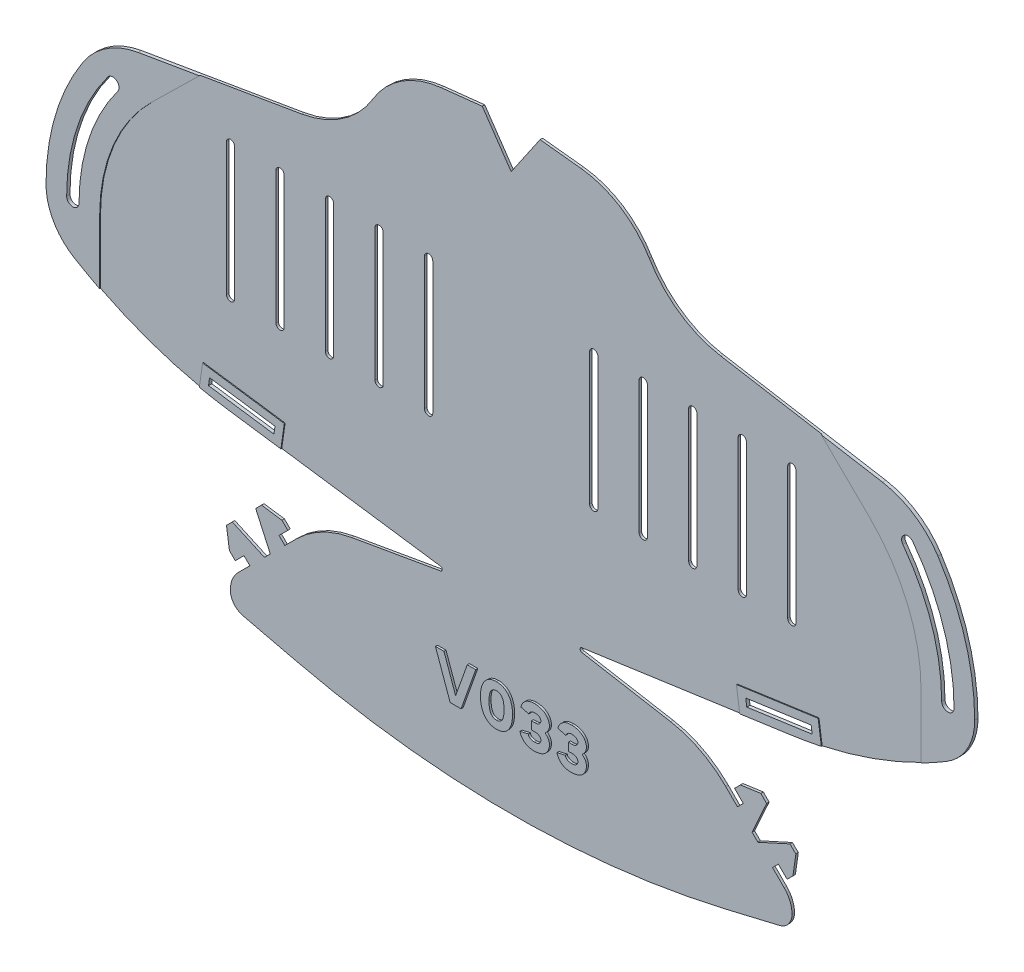
from build123d import *

# Parameters (mm, degrees)
MAIN_SHAPE_DEPTH                   = 0.6
ELASTIC_ATTACHMENT_POINTS_DEPTH    = 184.525502315
REINFORCED_ATTACHMENT_POINTS_DEPTH = 0.2
TAB_SLITS_DEPTH                    = 184.525502315
REINFORCED_TAB_SLITS_DEPTH         = 0.2
TAB_FLEX_RELIEF_DEPTH              = 184.525502315
TAB_FLEX_RELIEF_DEPTH_BACK         = 184.525502315
BREATHING_SLITS_DEPTH              = 184.525502315
VERSION_NUMBER_DEPTH               = 0.5
FILLET1_R                          = 0.5


with BuildPart() as part:
    # Sketch1 → Main Shape (new body)
    with BuildSketch(Plane.XY):
        with BuildLine():
            Line((0, -10.235233266), (-7, 0))
            Line((-7, 0), (-16.941855461, -1.076805455))
            ThreePointArc((-16.941855461, -1.076805455), (-26.448172688, -4.42923559), (-33.461443341, -11.669600897))
            ThreePointArc((-33.461443341, -11.669600897), (-40.804108255, -19.481824954), (-50.74391922, -23.5))
            Line((-50.74391922, -23.5), (-90.180351554, -30.190874742))
            ThreePointArc((-90.180351554, -30.190874742), (-97.811505455, -33.190405434), (-103.597722286, -39))
            ThreePointArc((-103.597722286, -39), (-110.227482046, -53.35351039), (-112.5, -69))
            ThreePointArc((-112.5, -69), (-110.685143325, -75.893640703), (-105.711102551, -81))
            ThreePointArc((-105.711102551, -81), (-87.655491519, -89.524485559), (-68.266232563, -94.291935705))
            Line((-68.266232563, -94.291935705), (-14, -102))
            Line((-14, -102), (-38.626554922, -106.304973016))
            ThreePointArc((-38.626554922, -106.304973016), (-45.849449199, -108.748014338), (-52, -113.254607005))
            Line((-52, -113.254607005), (-54.828307349, -116.0831539))
            Line((-54.828307349, -116.0831539), (-56.242580797, -114.669000226))
            Line((-56.242580797, -114.669000226), (-54.121350285, -112.547590054))
            Line((-54.121350285, -112.547590054), (-55.535623732, -111.13343638))
            Line((-55.535623732, -111.13343638), (-60.48540114, -110.426539202))
            Line((-60.48540114, -110.426539202), (-68.970323187, -118.912179887))
            Line((-68.970323187, -118.912179887), (-68.263006804, -123.861897408))
            Line((-68.263006804, -123.861897408), (-66.848733357, -125.276051082))
            Line((-66.848733357, -125.276051082), (-64.727502845, -123.154640911))
            Line((-64.727502845, -123.154640911), (-63.313229397, -124.568794586))
            Line((-63.313229397, -124.568794586), (-66.141536747, -127.397341481))
            ThreePointArc((-66.141536747, -127.397341481), (-67.550417669, -129.506025763), (-68.045148042, -131.993340924))
            ThreePointArc((-68.045148042, -131.993340924), (-67.183295285, -134.473669911), (-64.9691321, -135.885159709))
            Line((-64.9691321, -135.885159709), (-52.436095294, -138.860716087))
            ThreePointArc((-52.436095294, -138.860716087), (-26.397134772, -143.459954927), (0, -145))
            ThreePointArc((0, -145), (26.397134772, -143.459954927), (52.436095294, -138.860716087))
            Line((52.436095294, -138.860716087), (64.9691321, -135.885159709))
            ThreePointArc((64.9691321, -135.885159709), (67.183295285, -134.473669911), (68.045148042, -131.993340924))
            ThreePointArc((68.045148042, -131.993340924), (67.550417669, -129.506025763), (66.141536747, -127.397341481))
            Line((66.141536747, -127.397341481), (63.313229397, -124.568794586))
            Line((63.313229397, -124.568794586), (64.727502845, -123.154640911))
            Line((64.727502845, -123.154640911), (66.848733357, -125.276051082))
            Line((66.848733357, -125.276051082), (68.263006804, -123.861897408))
            Line((68.263006804, -123.861897408), (68.970323187, -118.912179887))
            Line((68.970323187, -118.912179887), (60.48540114, -110.426539202))
            Line((60.48540114, -110.426539202), (55.535623732, -111.13343638))
            Line((55.535623732, -111.13343638), (54.121350285, -112.547590054))
            Line((54.121350285, -112.547590054), (56.242580797, -114.669000226))
            Line((56.242580797, -114.669000226), (54.828307349, -116.0831539))
            Line((54.828307349, -116.0831539), (52, -113.254607005))
            ThreePointArc((52, -113.254607005), (45.849449199, -108.748014338), (38.626554922, -106.304973016))
            Line((38.626554922, -106.304973016), (14, -102))
            Line((14, -102), (68.266232563, -94.291935705))
            ThreePointArc((68.266232563, -94.291935705), (87.655491519, -89.524485559), (105.711102551, -81))
            ThreePointArc((105.711102551, -81), (110.685143325, -75.893640703), (112.5, -69))
            ThreePointArc((112.5, -69), (110.227482046, -53.35351039), (103.597722286, -39))
            ThreePointArc((103.597722286, -39), (97.811505455, -33.190405434), (90.180351554, -30.190874742))
            Line((90.180351554, -30.190874742), (50.74391922, -23.5))
            ThreePointArc((50.74391922, -23.5), (40.804108255, -19.481824954), (33.461443341, -11.669600897))
            ThreePointArc((33.461443341, -11.669600897), (26.448172688, -4.42923559), (16.941855461, -1.076805455))
            Line((16.941855461, -1.076805455), (7, 0))
            Line((7, 0), (0, -10.235233266))
        make_face()
    extrude(amount=MAIN_SHAPE_DEPTH)

    # Sketch2 → Elastic Attachment Points (cut, through all)
    with BuildSketch(Plane.XY.offset(0.6)):
        with BuildLine():
            ThreePointArc((-97.5, -39), (-104.934164903, -53.188611699), (-107.5, -69))
            ThreePointArc((-107.5, -69), (-106, -70.5), (-104.5, -69))
            ThreePointArc((-104.5, -69), (-102.088115008, -54.137294997), (-95.1, -40.8))
            ThreePointArc((-95.1, -40.8), (-95.4, -38.7), (-97.5, -39))
        make_face()
        with BuildLine():
            ThreePointArc((97.5, -39), (104.934164903, -53.188611699), (107.5, -69))
            ThreePointArc((107.5, -69), (106, -70.5), (104.5, -69))
            ThreePointArc((104.5, -69), (102.088115008, -54.137294997), (95.1, -40.8))
            ThreePointArc((95.1, -40.8), (95.4, -38.7), (97.5, -39))
        make_face()
    extrude(amount=-ELASTIC_ATTACHMENT_POINTS_DEPTH, mode=Mode.SUBTRACT)

    # Sketch7 → Reinforced Attachment Points (add)
    # profile 1 of 2: a face of its own
    with BuildSketch(Plane.XY.offset(0.6)):
        with BuildLine():
            Line((-99.5, -69), (-99.5, -84.438405623))
            ThreePointArc((-99.5, -84.438405623), (-102.636073846, -82.774338486), (-105.711102551, -81))
            ThreePointArc((-105.711102551, -81), (-110.685143325, -75.893640703), (-112.5, -69))
            ThreePointArc((-112.5, -69), (-110.227482046, -53.35351039), (-103.597722286, -39))
            ThreePointArc((-103.597722286, -39), (-97.811505455, -33.190405434), (-90.180351554, -30.190874742))
            Line((-90.180351554, -30.190874742), (-75.331937335, -27.671659038))
            Line((-75.331937335, -27.671659038), (-86.893876913, -39))
            ThreePointArc((-86.893876913, -39), (-96.22042633, -52.729517991), (-99.5, -69))
        make_face()
        with BuildLine():
            ThreePointArc((-107.5, -69), (-106, -70.5), (-104.5, -69))
            ThreePointArc((-104.5, -69), (-102.088115008, -54.137294997), (-95.1, -40.8))
            ThreePointArc((-95.1, -40.8), (-95.4, -38.7), (-97.5, -39))
            ThreePointArc((-97.5, -39), (-104.934164903, -53.188611699), (-107.5, -69))
        make_face(mode=Mode.SUBTRACT)
    # profile 2 of 2: a face of its own
    with BuildSketch(Plane.XY.offset(0.6)):
        with BuildLine():
            Line((75.331937335, -27.671659038), (90.180351554, -30.190874742))
            ThreePointArc((90.180351554, -30.190874742), (97.811505455, -33.190405434), (103.597722286, -39))
            ThreePointArc((103.597722286, -39), (110.227482046, -53.35351039), (112.5, -69))
            ThreePointArc((112.5, -69), (110.685143325, -75.893640703), (105.711102551, -81))
            ThreePointArc((105.711102551, -81), (102.636073846, -82.774338486), (99.5, -84.438405623))
            Line((99.5, -84.438405623), (99.5, -69))
            ThreePointArc((99.5, -69), (96.22042633, -52.729517991), (86.893876913, -39))
            Line((86.893876913, -39), (75.331937335, -27.671659038))
        make_face()
        with BuildLine():
            ThreePointArc((104.5, -69), (106, -70.5), (107.5, -69))
            ThreePointArc((107.5, -69), (104.934164903, -53.188611699), (97.5, -39))
            ThreePointArc((97.5, -39), (95.4, -38.7), (95.1, -40.8))
            ThreePointArc((95.1, -40.8), (102.088115008, -54.137294997), (104.5, -69))
        make_face(mode=Mode.SUBTRACT)
    extrude(amount=REINFORCED_ATTACHMENT_POINTS_DEPTH)

    # Sketch6 → Tab Slits (cut, through all)
    with BuildSketch(Plane.XY.offset(0.6)):
        Polygon((-73.122472744, -91.582072346), (-57.281477317, -93.832153206), (-57.02834322, -92.050041221), (-72.869338647, -89.79996036), align=None)
        Polygon((73.122472744, -91.582072346), (72.869338647, -89.79996036), (57.02834322, -92.050041221), (57.281477317, -93.832153206), align=None)
    extrude(amount=-TAB_SLITS_DEPTH, mode=Mode.SUBTRACT)

    # Sketch9 → Reinforced Tab Slits (add)
    # profile 1 of 2: a face of its own
    with BuildSketch(Plane.XY.offset(0.6)):
        with BuildLine():
            Line((-55.582612996, -96.093537742), (-54.766958684, -90.3511769))
            Line((-54.766958684, -90.3511769), (-74.568202968, -87.538575825))
            Line((-74.568202968, -87.538575825), (-75.347469499, -93.024759795))
            ThreePointArc((-75.347469499, -93.024759795), (-71.81824936, -93.72204393), (-68.266232563, -94.291935705))
            Line((-68.266232563, -94.291935705), (-55.582612996, -96.093537742))
        make_face()
        Polygon((-57.281477317, -93.832153206), (-57.02834322, -92.050041221), (-72.869338647, -89.79996036), (-73.122472744, -91.582072346), align=None, mode=Mode.SUBTRACT)
    # profile 2 of 2: a face of its own
    with BuildSketch(Plane.XY.offset(0.6)):
        with BuildLine():
            Line((68.266232563, -94.291935705), (55.582612996, -96.093537742))
            Line((55.582612996, -96.093537742), (54.766958684, -90.3511769))
            Line((54.766958684, -90.3511769), (74.568202968, -87.538575825))
            Line((74.568202968, -87.538575825), (75.347469499, -93.024759795))
            ThreePointArc((75.347469499, -93.024759795), (71.81824936, -93.72204393), (68.266232563, -94.291935705))
        make_face()
        Polygon((57.02834322, -92.050041221), (72.869338647, -89.79996036), (73.122472744, -91.582072346), (57.281477317, -93.832153206), align=None, mode=Mode.SUBTRACT)
    extrude(amount=REINFORCED_TAB_SLITS_DEPTH)

    # Sketch11 → Tab Flex Relief (cut, two sides: drawn at the far end of the back side and taken through both)
    with BuildSketch(Plane.XY.offset(0.6).offset(-TAB_FLEX_RELIEF_DEPTH_BACK)):
        Polygon((-67.556169513, -117.49790644), (-59.777845211, -121.033110967), (-58.363691536, -119.618837519), (-61.899554814, -111.840812649), align=None)
        Polygon((61.899554814, -111.840812649), (67.556169513, -117.49790644), (59.777845211, -121.033110967), (58.363691536, -119.618837519), align=None)
    extrude(amount=TAB_FLEX_RELIEF_DEPTH + TAB_FLEX_RELIEF_DEPTH_BACK, mode=Mode.SUBTRACT)

    # Sketch3 → Breathing Slits (cut, through all)
    with BuildSketch(Plane.XY.offset(0.6)):
        with BuildLine():
            Line((-19, -38.45), (-19, -70.45))
            ThreePointArc((-19, -70.45), (-20, -71.45), (-21, -70.45))
            Line((-21, -70.45), (-21, -38.45))
            ThreePointArc((-21, -38.45), (-20, -37.45), (-19, -38.45))
        make_face()
        with BuildLine():
            Line((-31, -38.45), (-31, -70.45))
            ThreePointArc((-31, -70.45), (-32, -71.45), (-33, -70.45))
            Line((-33, -70.45), (-33, -38.45))
            ThreePointArc((-33, -38.45), (-32, -37.45), (-31, -38.45))
        make_face()
        with BuildLine():
            Line((-43, -38.45), (-43, -70.45))
            ThreePointArc((-43, -70.45), (-44, -71.45), (-45, -70.45))
            Line((-45, -70.45), (-45, -38.45))
            ThreePointArc((-45, -38.45), (-44, -37.45), (-43, -38.45))
        make_face()
        with BuildLine():
            Line((-55, -38.45), (-55, -70.45))
            ThreePointArc((-55, -70.45), (-56, -71.45), (-57, -70.45))
            Line((-57, -70.45), (-57, -38.45))
            ThreePointArc((-57, -38.45), (-56, -37.45), (-55, -38.45))
        make_face()
        with BuildLine():
            Line((-67, -38.45), (-67, -70.45))
            ThreePointArc((-67, -70.45), (-68, -71.45), (-69, -70.45))
            Line((-69, -70.45), (-69, -38.45))
            ThreePointArc((-69, -38.45), (-68, -37.45), (-67, -38.45))
        make_face()
        with BuildLine():
            Line((19, -38.45), (19, -70.45))
            ThreePointArc((19, -70.45), (20, -71.45), (21, -70.45))
            Line((21, -70.45), (21, -38.45))
            ThreePointArc((21, -38.45), (20, -37.45), (19, -38.45))
        make_face()
        with BuildLine():
            Line((31, -38.45), (31, -70.45))
            ThreePointArc((31, -70.45), (32, -71.45), (33, -70.45))
            Line((33, -70.45), (33, -38.45))
            ThreePointArc((33, -38.45), (32, -37.45), (31, -38.45))
        make_face()
        with BuildLine():
            Line((43, -38.45), (43, -70.45))
            ThreePointArc((43, -70.45), (44, -71.45), (45, -70.45))
            Line((45, -70.45), (45, -38.45))
            ThreePointArc((45, -38.45), (44, -37.45), (43, -38.45))
        make_face()
        with BuildLine():
            Line((55, -38.45), (55, -70.45))
            ThreePointArc((55, -70.45), (56, -71.45), (57, -70.45))
            Line((57, -70.45), (57, -38.45))
            ThreePointArc((57, -38.45), (56, -37.45), (55, -38.45))
        make_face()
        with BuildLine():
            Line((67, -38.45), (67, -70.45))
            ThreePointArc((67, -70.45), (68, -71.45), (69, -70.45))
            Line((69, -70.45), (69, -38.45))
            ThreePointArc((69, -38.45), (68, -37.45), (67, -38.45))
        make_face()
    extrude(amount=-BREATHING_SLITS_DEPTH, mode=Mode.SUBTRACT)

    # Sketch8 → Version Number (add)
    # profile 1 of 4: a face of its own
    with BuildSketch(Plane.XY.offset(0.6)):
        Polygon((-14.279551662, -128.5), (-11.644631028, -128.5), (-8.073202456, -118.5), (-10.13669452, -118.5), (-12.962091345, -126.420634921), (-15.78748817, -118.5), (-17.850980234, -118.5), align=None)
    # profile 2 of 4: a face of its own
    with BuildSketch(Plane.XY.offset(0.6)):
        with BuildLine():
            add(Edge.make_bspline(
                [(-3.051027777, -118.5), (-3.19539374, -118.505695671), (-3.478148888, -118.51685121), (-3.891283889, -118.5745591), (-4.279126593, -118.680335178), (-4.646328168, -118.819656178), (-4.98860374, -119.003303471), (-5.312396914, -119.221085059), (-5.605407529, -119.487440084), (-5.880862582, -119.785519386), (-6.126725763, -120.12453761), (-6.340161473, -120.500892889), (-6.522124249, -120.912503383), (-6.671045413, -121.360169436), (-6.786594461, -121.844506854), (-6.8743484, -122.364485904), (-6.925902839, -122.921030718), (-6.936559569, -123.303893775), (-6.942038151, -123.500722112)],
                knots=[0, 0, 0, 0, 0.970159994, 1.900155169, 2.79438565, 3.665191596, 4.532301255, 5.397946305, 6.279238358, 7.185391655, 8.120220805, 9.085107467, 10.08639026, 11.138349125, 12.249459105, 13.427760297, 14.677622047, 16, 16, 16, 16], degree=3))
            add(Edge.make_bspline(
                [(-6.942038151, -123.500722112), (-6.93661476, -123.69832053), (-6.926106134, -124.081196856), (-6.874139064, -124.637697099), (-6.786693174, -125.156966907), (-6.670583318, -125.641884177), (-6.522640654, -126.090648826), (-6.340094029, -126.502814664), (-6.126783725, -126.879260377), (-5.880702545, -127.218032326), (-5.606310807, -127.51659595), (-5.310843261, -127.779877259), (-4.989492019, -128.000979952), (-4.646134714, -128.183632701), (-4.279581659, -128.324409639), (-3.89062858, -128.425104033), (-3.47885026, -128.488808035), (-3.196068886, -128.496221224), (-3.051924811, -128.5)],
                knots=[0, 0, 0, 0, 1.327400251, 2.57203543, 3.750234214, 4.861247624, 5.917991082, 6.919186852, 7.883989653, 8.818737555, 9.724812096, 10.602616666, 11.47109776, 12.338132057, 13.208862319, 14.101698703, 15.032365954, 16, 16, 16, 16], degree=3))
            add(Edge.make_bspline(
                [(-3.051924811, -128.5), (-2.907785142, -128.496210687), (-2.625012412, -128.488776824), (-2.213171998, -128.425221319), (-1.823749667, -128.323813307), (-1.456388189, -128.184839888), (-1.11399871, -128.000200623), (-0.792952303, -127.779984633), (-0.497553635, -127.516566079), (-0.223143835, -127.218040576), (0.022936792, -126.879258594), (0.236229534, -126.502813072), (0.418851411, -126.090657611), (0.566489149, -125.641847927), (0.683801999, -125.157235462), (0.766244145, -124.637275213), (0.82390037, -124.081441513), (0.831810739, -123.698369528), (0.835892123, -123.500722112)],
                knots=[0, 0, 0, 0, 0.96765053, 1.898333634, 2.791185227, 3.666728435, 4.529238626, 5.397734515, 6.275554038, 7.181644014, 8.116407839, 9.081227075, 10.082439899, 11.139201358, 12.250233695, 13.427610983, 14.672766316, 16, 16, 16, 16], degree=3))
            add(Edge.make_bspline(
                [(0.835892123, -123.500722112), (0.831751293, -123.303845261), (0.823694588, -122.920787111), (0.766450609, -122.364907693), (0.683702415, -121.844238468), (0.566952779, -121.360205444), (0.418334814, -120.912494629), (0.236296996, -120.500894477), (0.022878819, -120.124539393), (-0.222983775, -119.785511139), (-0.498457012, -119.487469991), (-0.79139822, -119.220977415), (-1.114883082, -119.004075275), (-1.45619473, -118.818455332), (-1.824205294, -118.680915067), (-2.212521926, -118.574534625), (-2.625371004, -118.516562336), (-2.907855835, -118.506550382), (-3.051924811, -118.501444225)],
                knots=[0, 0, 0, 0, 1.322391154, 2.572941942, 3.750582404, 4.861863084, 5.913983562, 6.915420183, 7.880455081, 8.815427849, 9.721720359, 10.603147806, 11.468925845, 12.331628829, 13.207367743, 14.101735605, 15.031873656, 16, 16, 16, 16], degree=3))
            Line((-3.051924811, -118.501444225), (-3.051027777, -118.5))
        make_face()
        with BuildLine():
            add(Edge.make_bspline(
                [(-3.051027777, -126.579365079), (-3.120347324, -126.580142247), (-3.25635765, -126.581667111), (-3.453810887, -126.549518886), (-3.640261982, -126.50001124), (-3.814439277, -126.424863461), (-3.978234638, -126.32888552), (-4.128850181, -126.207295998), (-4.267209205, -126.063513987), (-4.394524263, -125.896932623), (-4.508395565, -125.703005633), (-4.606926554, -125.478827118), (-4.687663969, -125.222713054), (-4.756840727, -124.937433189), (-4.808092092, -124.621763618), (-4.846595657, -124.276117752), (-4.872462321, -123.899148475), (-4.875821596, -123.63702081), (-4.87756832, -123.500722112)],
                knots=[0, 0, 0, 0, 0.820209436, 1.609314487, 2.362064528, 3.101854642, 3.850272983, 4.605479342, 5.3882482, 6.210255141, 7.084711649, 8.047345167, 9.106040688, 10.263495908, 11.523832392, 12.893430008, 14.384674726, 16, 16, 16, 16], degree=3))
            add(Edge.make_bspline(
                [(-4.87756832, -123.500722112), (-4.875814709, -123.364424703), (-4.87244219, -123.102299516), (-4.846666545, -122.725313211), (-4.807773571, -122.378974061), (-4.757477287, -122.063111109), (-4.687259864, -121.778059679), (-4.606956833, -121.522619394), (-4.508426672, -121.298401339), (-4.394392013, -121.104640769), (-4.268001709, -120.937923887), (-4.128039223, -120.796456824), (-3.978318472, -120.674830172), (-3.814478587, -120.578630118), (-3.639832567, -120.50465551), (-3.45446502, -120.450210023), (-3.256321312, -120.423926373), (-3.120878039, -120.422146526), (-3.051924811, -120.421240419)],
                knots=[0, 0, 0, 0, 1.616177311, 3.108208617, 4.478528655, 5.748482895, 6.897727805, 7.956981757, 8.920123036, 9.795040793, 10.617481319, 11.394165711, 12.149770419, 12.898583529, 13.63876386, 14.394368568, 15.182584207, 16, 16, 16, 16], degree=3))
            add(Edge.make_bspline(
                [(-3.051924811, -120.421240419), (-2.982973175, -120.422149219), (-2.847533031, -120.423934355), (-2.64936681, -120.450179948), (-2.464080223, -120.504762296), (-2.289746876, -120.577982734), (-2.127521541, -120.675595023), (-1.978051783, -120.796360516), (-1.838151536, -120.937948802), (-1.711787224, -121.104645093), (-1.597562487, -121.298351736), (-1.499777206, -121.523063414), (-1.415817348, -121.777554553), (-1.346628249, -122.063195246), (-1.29599857, -122.378948588), (-1.257206456, -122.725320897), (-1.231400792, -123.102297333), (-1.228032641, -123.364423957), (-1.226281301, -123.500722112)],
                knots=[0, 0, 0, 0, 0.817669415, 1.606129616, 2.361968767, 3.102378757, 3.843623451, 4.599462602, 5.376387978, 6.199083685, 7.074272906, 8.037713021, 9.100132017, 10.249733507, 11.520081779, 12.89082699, 14.383321233, 16, 16, 16, 16], degree=3))
            add(Edge.make_bspline(
                [(-1.226281301, -123.500722112), (-1.228025755, -123.637021556), (-1.231380663, -123.899150658), (-1.257277338, -124.276110066), (-1.295680288, -124.621789015), (-1.347263507, -124.937349474), (-1.415405372, -125.223220708), (-1.499806884, -125.478383327), (-1.597593739, -125.703055181), (-1.711654918, -125.896928348), (-1.838944061, -126.063488884), (-1.977240151, -126.207393621), (-2.12760424, -126.328120602), (-2.289785467, -126.425517476), (-2.463650718, -126.499891817), (-2.650020055, -126.549600883), (-2.847209684, -126.581404352), (-2.98290822, -126.580608552), (-3.051924811, -126.580203806)],
                knots=[0, 0, 0, 0, 1.616177474, 3.108208932, 4.478529109, 5.739530511, 6.897596372, 7.959685938, 8.922827315, 9.797745161, 10.620185771, 11.403367596, 12.15897238, 12.899987232, 13.640167639, 14.39331481, 15.182836171, 16, 16, 16, 16], degree=3))
            Line((-3.051924811, -126.580203806), (-3.051027777, -126.579365079))
        make_face(mode=Mode.SUBTRACT)
    # profile 3 of 4: a face of its own
    with BuildSketch(Plane.XY.offset(0.6)):
        with BuildLine():
            Line((6.271577031, -124.404761905), (6.366815126, -124.404761905))
            add(Edge.make_bspline(
                [(6.366815126, -124.404761905), (6.467083021, -124.411299477), (6.657718223, -124.423729091), (6.924384519, -124.486416557), (7.157178608, -124.578961335), (7.348865985, -124.709274647), (7.502511287, -124.861365804), (7.616838726, -125.032278467), (7.68649997, -125.222537651), (7.695375407, -125.355662585), (7.699852438, -125.422814713)],
                knots=[0, 0, 0, 0, 1.293250512, 2.458803691, 3.516087315, 4.504014474, 5.424976382, 6.287022232, 7.135923681, 8, 8, 8, 8], degree=3))
            add(Edge.make_bspline(
                [(7.699852438, -125.422814713), (7.696562888, -125.504440638), (7.690201902, -125.662280257), (7.62105453, -125.887718235), (7.502699673, -126.087113891), (7.367783836, -126.23073656), (7.23861918, -126.331172702), (7.123730184, -126.395688771), (6.994879285, -126.450185226), (6.851851279, -126.49595932), (6.69512982, -126.532200484), (6.524170883, -126.560253509), (6.33834716, -126.575366879), (6.209508164, -126.5785552), (6.142888539, -126.580203806)],
                knots=[0, 0, 0, 0, 1.334208421, 2.579951764, 3.816761299, 5.103436918, 5.78324123, 6.491044783, 7.25516555, 8.072210043, 8.94833879, 9.888551629, 10.908219533, 12, 12, 12, 12], degree=3))
            add(Edge.make_bspline(
                [(6.142888539, -126.580203806), (6.068494948, -126.579024673), (5.918010355, -126.576639503), (5.691363809, -126.537785365), (5.463088851, -126.472292557), (5.235991452, -126.384048723), (5.021834851, -126.26078738), (4.844512322, -126.088542309), (4.703342567, -125.87591894), (4.648773412, -125.712337396), (4.620370744, -125.62719493)],
                knots=[0, 0, 0, 0, 0.920255672, 1.861508472, 2.836752399, 3.857684402, 4.873720033, 5.872631744, 6.892727297, 8, 8, 8, 8], degree=3))
            Line((4.620370744, -125.62719493), (2.636656396, -126.071428571))
            add(Edge.make_bspline(
                [(2.636656396, -126.071428571), (2.65949168, -126.160336196), (2.704447825, -126.335369884), (2.797456704, -126.586847228), (2.908894142, -126.824009097), (3.034050485, -127.050933458), (3.182201572, -127.26169635), (3.346370111, -127.459934114), (3.525601641, -127.647890635), (3.725933933, -127.819546753), (3.943380911, -127.976110236), (4.180527485, -128.112422888), (4.435092983, -128.230322428), (4.710630373, -128.322934743), (5.002747988, -128.399729339), (5.314016557, -128.45295857), (5.642847536, -128.491934936), (5.868729028, -128.497268097), (5.984436461, -128.5)],
                knots=[0, 0, 0, 0, 0.97897001, 1.927311989, 2.855460552, 3.773345826, 4.68872018, 5.599601379, 6.518067916, 7.456260856, 8.41049365, 9.372940738, 10.370680865, 11.39871829, 12.470472684, 13.590411754, 14.765692276, 16, 16, 16, 16], degree=3))
            add(Edge.make_bspline(
                [(5.984436461, -128.5), (6.140706347, -128.494245394), (6.443232397, -128.483104934), (6.881041186, -128.435865678), (7.286689568, -128.358387224), (7.66046436, -128.252017359), (8.005338054, -128.123277608), (8.316323474, -127.961059217), (8.598414909, -127.774497038), (8.846068931, -127.55815064), (9.060463644, -127.319870658), (9.252221218, -127.071551477), (9.410010509, -126.805353082), (9.542541163, -126.527874631), (9.641168787, -126.234513517), (9.712632491, -125.928607165), (9.754304892, -125.607680152), (9.759422526, -125.38925418), (9.762025861, -125.278141077)],
                knots=[0, 0, 0, 0, 1.338573179, 2.591371041, 3.766159492, 4.869841347, 5.915366975, 6.911991706, 7.866279139, 8.804635322, 9.718527085, 10.607232931, 11.486170613, 12.362759498, 13.235296616, 14.130311397, 15.048891017, 16, 16, 16, 16], degree=3))
            add(Edge.make_bspline(
                [(9.762025861, -125.278141077), (9.756677435, -125.181448476), (9.746150675, -124.991138356), (9.69083509, -124.713321084), (9.598475202, -124.451246621), (9.469283463, -124.20784025), (9.318083758, -123.977552327), (9.142952342, -123.764837772), (8.948555296, -123.566155092), (8.80413063, -123.449574998), (8.73093915, -123.39049458)],
                knots=[0, 0, 0, 0, 1.042147361, 2.051151675, 3.039496243, 4.024119517, 5.012016893, 6.002285516, 6.987598979, 8, 8, 8, 8], degree=3))
            add(Edge.make_bspline(
                [(8.73093915, -123.39049458), (8.804120184, -123.325162044), (8.948480941, -123.19628365), (9.142753063, -122.981710509), (9.316923769, -122.755542958), (9.470279521, -122.515248899), (9.597481046, -122.261642739), (9.690305135, -121.993228321), (9.746213398, -121.711764564), (9.756698785, -121.519933272), (9.762025861, -121.42247384)],
                knots=[0, 0, 0, 0, 1.026734164, 2.025389794, 3.025877614, 4.013273499, 5.006315215, 5.989929209, 6.978788314, 8, 8, 8, 8], degree=3))
            add(Edge.make_bspline(
                [(9.762025861, -121.42247384), (9.757943996, -121.322020203), (9.749925017, -121.124675201), (9.70298232, -120.835115028), (9.627804305, -120.558271626), (9.520362248, -120.294880847), (9.386946652, -120.042407113), (9.222134738, -119.803370965), (9.03110556, -119.574583887), (8.810274701, -119.361344215), (8.563575543, -119.166999953), (8.291767327, -118.995833154), (7.997228637, -118.84746887), (7.676452584, -118.730513446), (7.334536967, -118.632405283), (6.968657131, -118.562780212), (6.579581976, -118.515976725), (6.312193885, -118.506371293), (6.175038236, -118.501444225)],
                knots=[0, 0, 0, 0, 0.933249724, 1.833404674, 2.71837752, 3.592513965, 4.4704886, 5.365912677, 6.284554944, 7.234984132, 8.212272519, 9.196674926, 10.214289296, 11.269589965, 12.363543901, 13.515449053, 14.72555956, 16, 16, 16, 16], degree=3))
            add(Edge.make_bspline(
                [(6.175038236, -118.501444225), (6.061645884, -118.504384419), (5.840465125, -118.510119502), (5.517680855, -118.546209564), (5.21185155, -118.597359567), (4.923032824, -118.671164203), (4.651989267, -118.76520159), (4.398267184, -118.877770477), (4.16173765, -119.009217236), (3.94413438, -119.161041577), (3.743873805, -119.328960798), (3.562476817, -119.510905494), (3.397729823, -119.704452098), (3.253195647, -119.91288512), (3.123566172, -120.132286581), (3.017031143, -120.36651166), (2.922112184, -120.610059019), (2.878707966, -120.780460499), (2.856730222, -120.866743363)],
                knots=[0, 0, 0, 0, 1.229240767, 2.397731417, 3.51786287, 4.588673614, 5.625367482, 6.624717489, 7.594406979, 8.554388623, 9.496885304, 10.424058211, 11.336820069, 12.248524965, 13.170856983, 14.095351914, 15.035580601, 16, 16, 16, 16], degree=3))
            Line((2.856730222, -120.866743363), (4.763640523, -121.373015873))
            add(Edge.make_bspline(
                [(4.763640523, -121.373015873), (4.774938173, -121.326631527), (4.799454349, -121.22597637), (4.889955476, -121.081457089), (5.01180415, -120.927147787), (5.173016925, -120.771324055), (5.370394698, -120.625559671), (5.608484676, -120.514206488), (5.881569063, -120.446844288), (6.0743985, -120.430020784), (6.175038236, -120.421240419)],
                knots=[0, 0, 0, 0, 0.626586808, 1.359708585, 2.222843852, 3.223153095, 4.308434095, 5.447412619, 6.667777482, 8, 8, 8, 8], degree=3))
            add(Edge.make_bspline(
                [(6.175038236, -120.421240419), (6.247071222, -120.423218633), (6.385306711, -120.42701494), (6.582710033, -120.449676308), (6.76300166, -120.474391788), (6.924051066, -120.515621967), (7.069666073, -120.558109891), (7.194275259, -120.618078056), (7.305036594, -120.680273756), (7.419940282, -120.780934624), (7.534268273, -120.912654377), (7.637262225, -121.077310889), (7.69725924, -121.24921056), (7.698998308, -121.365405566), (7.699852438, -121.42247384)],
                knots=[0, 0, 0, 0, 1.26888152, 2.435057415, 3.499383416, 4.470882074, 5.362320585, 6.164854387, 6.902680001, 7.591682225, 8.843898063, 9.963361673, 10.999720905, 12, 12, 12, 12], degree=3))
            add(Edge.make_bspline(
                [(7.699852438, -121.42247384), (7.694781684, -121.49199044), (7.684703485, -121.630155711), (7.609424673, -121.827940252), (7.48789936, -122.008163808), (7.324572613, -122.171288708), (7.117236705, -122.307565764), (6.86969973, -122.408872593), (6.582819396, -122.47003825), (6.378964553, -122.480300003), (6.271487327, -122.485710249)],
                knots=[0, 0, 0, 0, 0.842573162, 1.674626639, 2.532888499, 3.465967991, 4.458251597, 5.524776888, 6.695002246, 8, 8, 8, 8], degree=3))
            Line((6.271487327, -122.485710249), (5.414434173, -122.484126984))
            Line((5.414434173, -122.484126984), (5.414434173, -124.404761905))
            Line((5.414434173, -124.404761905), (6.271577031, -124.404761905))
        make_face()
    # profile 4 of 4: a face of its own
    with BuildSketch(Plane.XY.offset(0.6)):
        with BuildLine():
            Line((15.236749687, -124.404761905), (15.331987782, -124.404761905))
            add(Edge.make_bspline(
                [(15.331987782, -124.404761905), (15.432255678, -124.411299477), (15.622890879, -124.423729091), (15.889557176, -124.486416557), (16.122351264, -124.578961335), (16.314038642, -124.709274647), (16.467683943, -124.861365804), (16.582011382, -125.032278467), (16.651672626, -125.222537651), (16.660548063, -125.355662585), (16.665025095, -125.422814713)],
                knots=[0, 0, 0, 0, 1.293250512, 2.458803691, 3.516087315, 4.504014474, 5.424976382, 6.287022232, 7.135923681, 8, 8, 8, 8], degree=3))
            add(Edge.make_bspline(
                [(16.665025095, -125.422814713), (16.661735544, -125.504440638), (16.655374558, -125.662280257), (16.586227187, -125.887718235), (16.467872329, -126.087113891), (16.332956492, -126.23073656), (16.203791837, -126.331172702), (16.088902841, -126.395688771), (15.960051942, -126.450185226), (15.817023936, -126.49595932), (15.660302476, -126.532200484), (15.489343539, -126.560253509), (15.303519817, -126.575366879), (15.174680821, -126.5785552), (15.108061196, -126.580203806)],
                knots=[0, 0, 0, 0, 1.334208421, 2.579951764, 3.816761299, 5.103436918, 5.78324123, 6.491044783, 7.25516555, 8.072210043, 8.94833879, 9.888551629, 10.908219533, 12, 12, 12, 12], degree=3))
            add(Edge.make_bspline(
                [(15.108061196, -126.580203806), (15.033667605, -126.579024673), (14.883183012, -126.576639503), (14.656536466, -126.537785365), (14.428261508, -126.472292557), (14.201164108, -126.384048723), (13.987007508, -126.26078738), (13.809684979, -126.088542309), (13.668515223, -125.87591894), (13.613946069, -125.712337396), (13.585543401, -125.62719493)],
                knots=[0, 0, 0, 0, 0.920255672, 1.861508472, 2.836752399, 3.857684402, 4.873720033, 5.872631744, 6.892727297, 8, 8, 8, 8], degree=3))
            Line((13.585543401, -125.62719493), (11.601829052, -126.071428571))
            add(Edge.make_bspline(
                [(11.601829052, -126.071428571), (11.624664337, -126.160336196), (11.669620481, -126.335369884), (11.762629361, -126.586847228), (11.874066798, -126.824009097), (11.999223142, -127.050933458), (12.147374228, -127.26169635), (12.311542768, -127.459934114), (12.490774297, -127.647890635), (12.69110659, -127.819546753), (12.908553568, -127.976110236), (13.145700141, -128.112422888), (13.40026564, -128.230322428), (13.675803029, -128.322934743), (13.967920645, -128.399729339), (14.279189214, -128.45295857), (14.608020193, -128.491934936), (14.833901685, -128.497268097), (14.949609117, -128.5)],
                knots=[0, 0, 0, 0, 0.97897001, 1.927311989, 2.855460552, 3.773345826, 4.68872018, 5.599601379, 6.518067916, 7.456260856, 8.41049365, 9.372940738, 10.370680865, 11.39871829, 12.470472684, 13.590411754, 14.765692276, 16, 16, 16, 16], degree=3))
            add(Edge.make_bspline(
                [(14.949609117, -128.5), (15.105879003, -128.494245394), (15.408405054, -128.483104934), (15.846213843, -128.435865678), (16.251862225, -128.358387224), (16.625637017, -128.252017359), (16.97051071, -128.123277608), (17.281496131, -127.961059217), (17.563587566, -127.774497038), (17.811241588, -127.55815064), (18.025636301, -127.319870658), (18.217393875, -127.071551477), (18.375183166, -126.805353082), (18.50771382, -126.527874631), (18.606341444, -126.234513517), (18.677805148, -125.928607165), (18.719477549, -125.607680152), (18.724595182, -125.38925418), (18.727198518, -125.278141077)],
                knots=[0, 0, 0, 0, 1.338573179, 2.591371041, 3.766159492, 4.869841347, 5.915366975, 6.911991706, 7.866279139, 8.804635322, 9.718527085, 10.607232931, 11.486170613, 12.362759498, 13.235296616, 14.130311397, 15.048891017, 16, 16, 16, 16], degree=3))
            add(Edge.make_bspline(
                [(18.727198518, -125.278141077), (18.721850091, -125.181448476), (18.711323332, -124.991138356), (18.656007747, -124.713321084), (18.563647859, -124.451246621), (18.43445612, -124.20784025), (18.283256415, -123.977552327), (18.108124998, -123.764837772), (17.913727952, -123.566155092), (17.769303286, -123.449574998), (17.696111806, -123.39049458)],
                knots=[0, 0, 0, 0, 1.042147361, 2.051151675, 3.039496243, 4.024119517, 5.012016893, 6.002285516, 6.987598979, 8, 8, 8, 8], degree=3))
            add(Edge.make_bspline(
                [(17.696111806, -123.39049458), (17.769292841, -123.325162044), (17.913653598, -123.19628365), (18.10792572, -122.981710509), (18.282096426, -122.755542958), (18.435452178, -122.515248899), (18.562653702, -122.261642739), (18.655477791, -121.993228321), (18.711386055, -121.711764564), (18.721871442, -121.519933272), (18.727198518, -121.42247384)],
                knots=[0, 0, 0, 0, 1.026734164, 2.025389794, 3.025877614, 4.013273499, 5.006315215, 5.989929209, 6.978788314, 8, 8, 8, 8], degree=3))
            add(Edge.make_bspline(
                [(18.727198518, -121.42247384), (18.723116653, -121.322020203), (18.715097674, -121.124675201), (18.668154976, -120.835115028), (18.592976962, -120.558271626), (18.485534904, -120.294880847), (18.352119309, -120.042407113), (18.187307394, -119.803370965), (17.996278216, -119.574583887), (17.775447358, -119.361344215), (17.5287482, -119.166999953), (17.256939983, -118.995833154), (16.962401294, -118.84746887), (16.641625241, -118.730513446), (16.299709624, -118.632405283), (15.933829787, -118.562780212), (15.544754633, -118.515976725), (15.277366541, -118.506371293), (15.140210893, -118.501444225)],
                knots=[0, 0, 0, 0, 0.933249724, 1.833404674, 2.71837752, 3.592513965, 4.4704886, 5.365912677, 6.284554944, 7.234984132, 8.212272519, 9.196674926, 10.214289296, 11.269589965, 12.363543901, 13.515449053, 14.72555956, 16, 16, 16, 16], degree=3))
            add(Edge.make_bspline(
                [(15.140210893, -118.501444225), (15.02681854, -118.504384419), (14.805637781, -118.510119502), (14.482853511, -118.546209564), (14.177024207, -118.597359567), (13.888205481, -118.671164203), (13.617161924, -118.76520159), (13.36343984, -118.877770477), (13.126910307, -119.009217236), (12.909307037, -119.161041577), (12.709046461, -119.328960798), (12.527649473, -119.510905494), (12.36290248, -119.704452098), (12.218368304, -119.91288512), (12.088738829, -120.132286581), (11.9822038, -120.36651166), (11.887284841, -120.610059019), (11.843880623, -120.780460499), (11.821902878, -120.866743363)],
                knots=[0, 0, 0, 0, 1.229240767, 2.397731417, 3.51786287, 4.588673614, 5.625367482, 6.624717489, 7.594406979, 8.554388623, 9.496885304, 10.424058211, 11.336820069, 12.248524965, 13.170856983, 14.095351914, 15.035580601, 16, 16, 16, 16], degree=3))
            Line((11.821902878, -120.866743363), (13.728813179, -121.373015873))
            add(Edge.make_bspline(
                [(13.728813179, -121.373015873), (13.74011083, -121.326631527), (13.764627005, -121.22597637), (13.855128132, -121.081457089), (13.976976807, -120.927147787), (14.138189582, -120.771324055), (14.335567355, -120.625559671), (14.573657333, -120.514206488), (14.846741719, -120.446844288), (15.039571157, -120.430020784), (15.140210893, -120.421240419)],
                knots=[0, 0, 0, 0, 0.626586808, 1.359708585, 2.222843852, 3.223153095, 4.308434095, 5.447412619, 6.667777482, 8, 8, 8, 8], degree=3))
            add(Edge.make_bspline(
                [(15.140210893, -120.421240419), (15.212243879, -120.423218633), (15.350479367, -120.42701494), (15.547882689, -120.449676308), (15.728174317, -120.474391788), (15.889223723, -120.515621967), (16.03483873, -120.558109891), (16.159447916, -120.618078056), (16.270209251, -120.680273756), (16.385112939, -120.780934624), (16.499440929, -120.912654377), (16.602434882, -121.077310889), (16.662431897, -121.24921056), (16.664170965, -121.365405566), (16.665025095, -121.42247384)],
                knots=[0, 0, 0, 0, 1.26888152, 2.435057415, 3.499383416, 4.470882074, 5.362320585, 6.164854387, 6.902680001, 7.591682225, 8.843898063, 9.963361673, 10.999720905, 12, 12, 12, 12], degree=3))
            add(Edge.make_bspline(
                [(16.665025095, -121.42247384), (16.659954341, -121.49199044), (16.649876142, -121.630155711), (16.57459733, -121.827940252), (16.453072017, -122.008163808), (16.28974527, -122.171288708), (16.082409362, -122.307565764), (15.834872386, -122.408872593), (15.547992052, -122.47003825), (15.344137209, -122.480300003), (15.236659984, -122.485710249)],
                knots=[0, 0, 0, 0, 0.842573162, 1.674626639, 2.532888499, 3.465967991, 4.458251597, 5.524776888, 6.695002246, 8, 8, 8, 8], degree=3))
            Line((15.236659984, -122.485710249), (14.37960683, -122.484126984))
            Line((14.37960683, -122.484126984), (14.37960683, -124.404761905))
            Line((14.37960683, -124.404761905), (15.236749687, -124.404761905))
        make_face()
    extrude(amount=VERSION_NUMBER_DEPTH)

    # Fillet1
    fillet1_edges = [part.edges().sort_by_distance(p)[0] for p in [
        (14, -102, 0.3),
        (-14, -102, 0.3),
    ]]
    fillet(fillet1_edges, radius=FILLET1_R)


solid = part.part
